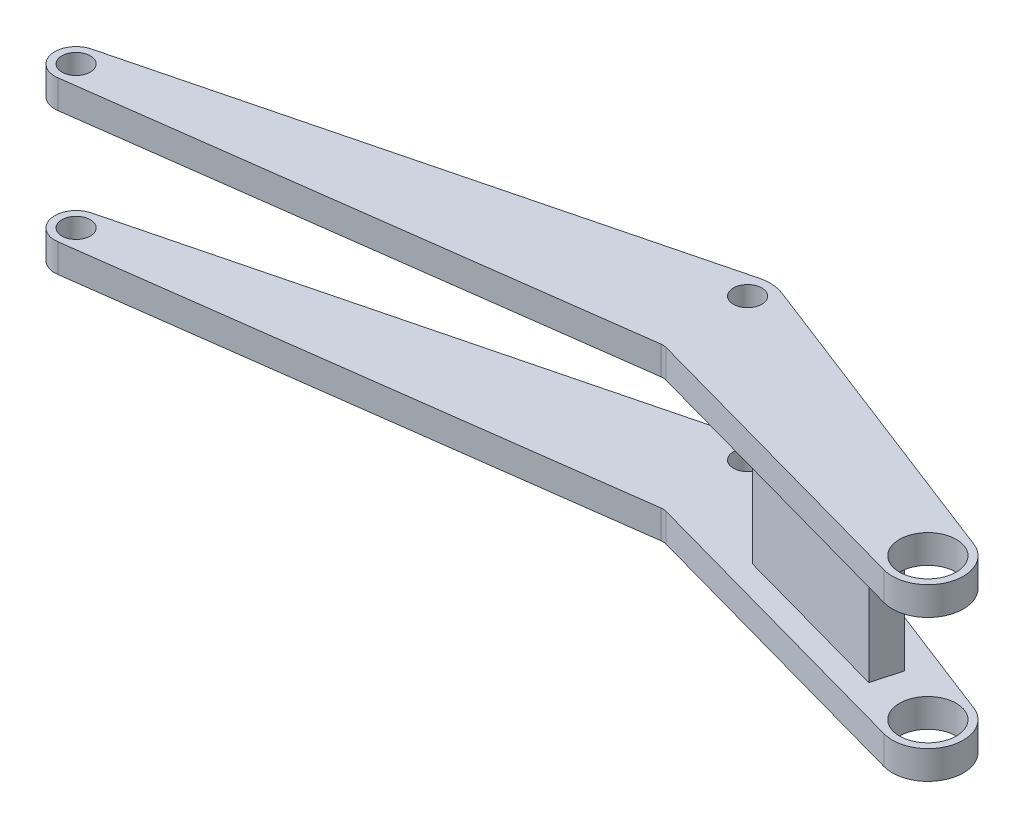
from build123d import *

# Parameters (mm, degrees)
BOSS_EXTRUDE3_DEPTH = 60
SKETCH4_R           = 10
SKETCH4_R_2         = 5
CUT_EXTRUDE2_DEPTH  = 98.5
SKETCH5_W           = 377.10594696
SKETCH5_H           = 125.451579965
CUT_EXTRUDE3_DEPTH  = 20
SKETCH6_R           = 5
CUT_EXTRUDE4_DEPTH  = 40.5


with BuildPart() as part:
    # Sketch1 → Boss-Extrude3 (new body)
    with BuildSketch(Plane(origin=(0, 0, 0), x_dir=(1, 0, 0), z_dir=(0, 1, 0))):
        with BuildLine():
            Line((-63.667210577, 7.268578883), (123.791080386, 54.947452974))
            ThreePointArc((123.791080386, 54.947452974), (128.085809082, 55.353988191), (132.30042121, 54.43365669))
            Line((132.30042121, 54.43365669), (242.697935991, 11.655551457))
            ThreePointArc((242.697935991, 11.655551457), (250.046544834, -3.933307136), (234.840986043, -12.045368899))
            Line((234.840986043, -12.045368899), (128.578230905, 17.424304308))
            ThreePointArc((128.578230905, 17.424304308), (127.586579666, 17.594270625), (126.58097714, 17.562266071))
            Line((126.58097714, 17.562266071), (-60.826924457, -7.434163985))
            ThreePointArc((-60.826924457, -7.434163985), (-69.182345376, -1.422554364), (-63.667210577, 7.268578883))
        make_face()
    extrude(amount=BOSS_EXTRUDE3_DEPTH)

    # Sketch4 → Cut-Extrude2 (cut, symmetric)
    with BuildSketch(Plane(origin=(0, 30, 0), x_dir=(1, 0, 0), z_dir=(0, 1, 0))):
        with Locations(Location((238.181508173, 0, 0), (0, 0, 270))):
            Circle(SKETCH4_R)
        with Locations(Location((-61.818491827, 0, 0), (0, 0, 270))):
            Circle(SKETCH4_R_2)
    extrude(amount=CUT_EXTRUDE2_DEPTH, both=True, mode=Mode.SUBTRACT)

    # Sketch5 → Cut-Extrude3 (cut, symmetric)
    with BuildSketch(Plane(origin=(0, 30, 0), x_dir=(1, 0, 0), z_dir=(0, 1, 0))):
        with Locations((90.046698809, 24.704131579)):
            Rectangle(SKETCH5_W, SKETCH5_H)
        Polygon((159.740207612, 16.633427142), (216.469846148, 0.900690808), (219.199055149, 10.741765928), (164.034407851, 32.117601172), align=None, mode=Mode.SUBTRACT)
    extrude(amount=CUT_EXTRUDE3_DEPTH, both=True, mode=Mode.SUBTRACT)

    # Sketch6 → Cut-Extrude4 (cut, symmetric)
    with BuildSketch(Plane(origin=(0, 30, 0), x_dir=(1, 0, 0), z_dir=(0, 1, 0))):
        with Locations(Location((127.242022054, 47.44112623, 0), (0, 0, 270))):
            Circle(SKETCH6_R)
    extrude(amount=CUT_EXTRUDE4_DEPTH, both=True, mode=Mode.SUBTRACT)


solid = part.part
